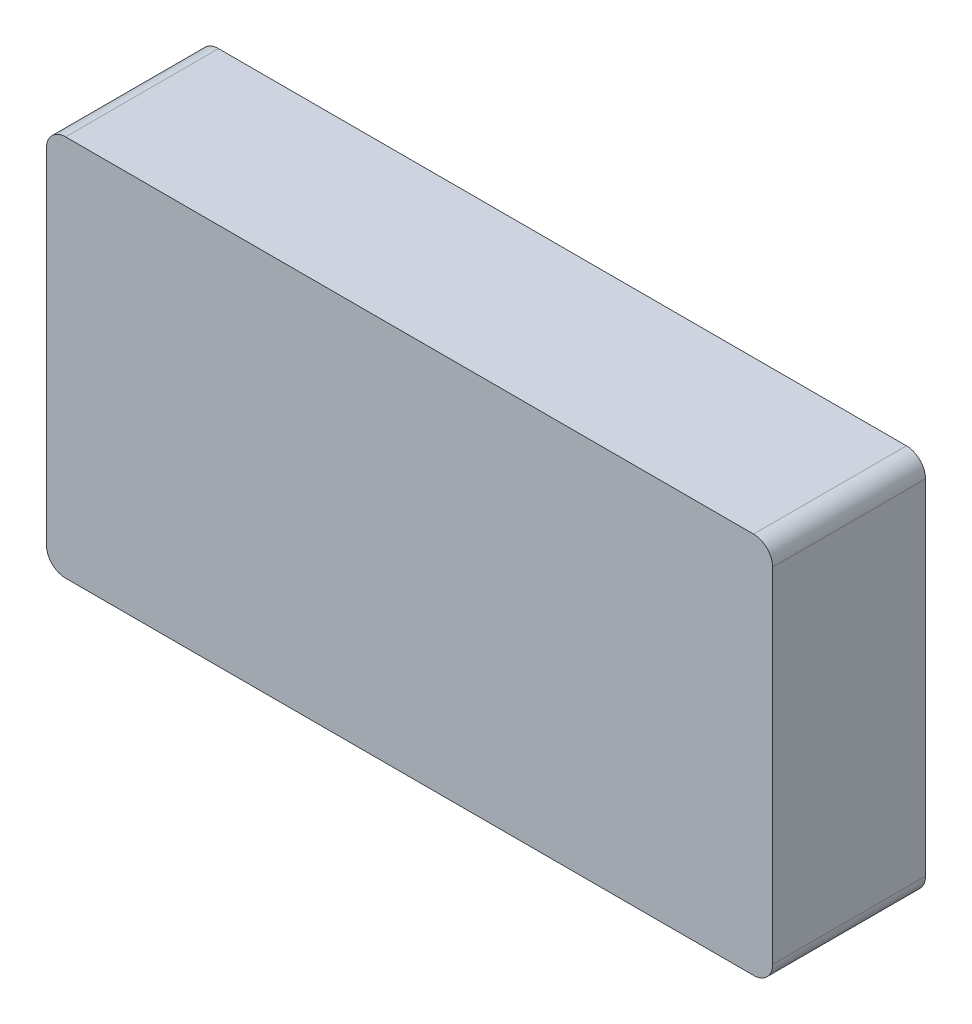
from build123d import *

# Parameters (mm, degrees)
Y_KSEKLIK_EKSTR_ZYON1_DEPTH = 40
BO_ALTMA1_T                 = -3
Y_KSEKLIK_EKSTR_ZYON2_START = -3
Y_KSEKLIK_EKSTR_ZYON2_DEPTH = 3


with BuildPart() as part:
    # Çizim1 → Yükseklik-Ekstrüzyon1 (new body)
    with BuildSketch(Plane.XY):
        with BuildLine():
            Line((-90, 50), (90, 50))
            ThreePointArc((90, 50), (93.535533906, 48.535533906), (95, 45))
            Line((95, 45), (95, -45))
            ThreePointArc((95, -45), (93.535533906, -48.535533906), (90, -50))
            Line((90, -50), (-90, -50))
            ThreePointArc((-90, -50), (-93.535533906, -48.535533906), (-95, -45))
            Line((-95, -45), (-95, 45))
            ThreePointArc((-95, 45), (-93.535533906, 48.535533906), (-90, 50))
        make_face()
    extrude(amount=Y_KSEKLIK_EKSTR_ZYON1_DEPTH)

    # İç Boşaltma1
    bo_altma1_openings = [part.faces().sort_by_distance(p)[0] for p in [
        (0, 0, 40),
    ]]
    offset(amount=BO_ALTMA1_T, openings=bo_altma1_openings, kind=Kind.INTERSECTION)

    # Çizim2 → Yükseklik-Ekstrüzyon2 (add)
    with BuildSketch(Plane.XY.offset(40).offset(Y_KSEKLIK_EKSTR_ZYON2_START)):
        with BuildLine():
            Line((90, 47), (-90, 47))
            ThreePointArc((-90, 47), (-91.414213562, 46.414213562), (-92, 45))
            Line((-92, 45), (-92, -45))
            ThreePointArc((-92, -45), (-91.414213562, -46.414213562), (-90, -47))
            Line((-90, -47), (90, -47))
            ThreePointArc((90, -47), (91.414213562, -46.414213562), (92, -45))
            Line((92, -45), (92, 45))
            ThreePointArc((92, 45), (91.414213562, 46.414213562), (90, 47))
        make_face()
    extrude(amount=Y_KSEKLIK_EKSTR_ZYON2_DEPTH)


solid = part.part
